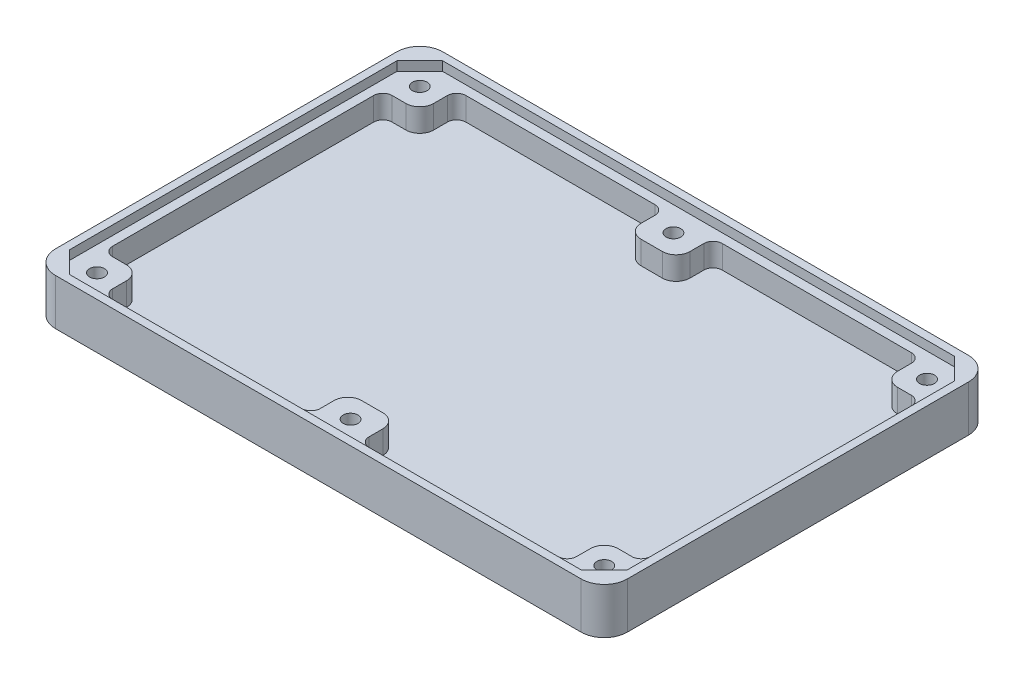
from build123d import *

# Parameters (mm, degrees)
SKETCH1_W           = 124
SKETCH1_H           = 84
BOSS_EXTRUDE1_DEPTH = 10
CUT_EXTRUDE1_DEPTH  = 2
SKETCH3_W           = 120.6
SKETCH3_H           = 60.6
CUT_EXTRUDE2_DEPTH  = 5
SKETCH4_W           = 45
SKETCH4_H           = 10
CUT_EXTRUDE3_DEPTH  = 5
FILLET1_R           = 3
FILLET2_R           = 5
SKETCH5_R           = 1.6
CUT_EXTRUDE4_DEPTH  = 238.548265663
SKETCH7_W           = 5.6
SKETCH7_H           = 7
CUT_EXTRUDE5_DEPTH  = 4
SKETCH8_W           = 100.6
SKETCH8_H           = 2
SKETCH8_W_2         = 2
SKETCH8_H_2         = 60.6
BOSS_EXTRUDE2_DEPTH = 5
FILLET3_R           = 2


with BuildPart() as part:
    # Sketch1 → Boss-Extrude1 (new body)
    with BuildSketch(Plane(origin=(0, 0, 0), x_dir=(1, 0, 0), z_dir=(0, 1, 0))):
        with Locations((-159.312972905, -43.940366204)):
            Rectangle(SKETCH1_W, SKETCH1_H)
    extrude(amount=BOSS_EXTRUDE1_DEPTH)

    # Sketch2 → Cut-Extrude1 (cut)
    with BuildSketch(Plane(origin=(0, 10, 0), x_dir=(1, 0, 0), z_dir=(0, 1, 0))):
        Polygon((-214.663225437, -3.640366204), (-219.612972905, -8.590113673), (-219.612972905, -79.590113673), (-214.962720373, -84.240366204), (-103.962720373, -84.240366204), (-99.012972905, -79.290618736), (-99.012972905, -8.290618736), (-103.663225437, -3.640366204), align=None)
    extrude(amount=-CUT_EXTRUDE1_DEPTH, mode=Mode.SUBTRACT)

    # Sketch3 → Cut-Extrude2 (cut)
    with BuildSketch(Plane(origin=(0, 8, 0), x_dir=(1, 0, 0), z_dir=(0, 1, 0))):
        with Locations((-159.312972905, -43.940366204)):
            Rectangle(SKETCH3_W, SKETCH3_H)
    extrude(amount=-CUT_EXTRUDE2_DEPTH, mode=Mode.SUBTRACT)

    # Sketch4 → Cut-Extrude3 (cut)
    with BuildSketch(Plane(origin=(0, 8, 0), x_dir=(1, 0, 0), z_dir=(0, 1, 0))):
        with Locations((-187.112972905, -8.640366204)):
            Rectangle(SKETCH4_W, SKETCH4_H)
        with Locations((-131.512972905, -8.640366204)):
            Rectangle(SKETCH4_W, SKETCH4_H)
        with Locations((-131.512972905, -79.240366204)):
            Rectangle(SKETCH4_W, SKETCH4_H)
        with Locations((-187.112972905, -79.240366204)):
            Rectangle(SKETCH4_W, SKETCH4_H)
    extrude(amount=-CUT_EXTRUDE3_DEPTH, mode=Mode.SUBTRACT)

    # Fillet1
    fillet1_edges = [part.edges().sort_by_distance(p)[0] for p in [
        (-209.612972905, 5.5, 74.240366204),
        (-164.612972905, 5.5, 74.240366204),
        (-109.012972905, 5.5, 74.240366204),
        (-154.012972905, 5.5, 74.240366204),
        (-154.012972905, 5.5, 13.640366204),
        (-109.012972905, 5.5, 13.640366204),
        (-209.612972905, 5.5, 13.640366204),
        (-164.612972905, 5.5, 13.640366204),
    ]]
    fillet(fillet1_edges, radius=FILLET1_R)

    # Fillet2
    fillet2_edges = [part.edges().sort_by_distance(p)[0] for p in [
        (-221.312972905, 5, 1.940366204),
        (-97.312972905, 5, 1.940366204),
        (-97.312972905, 5, 85.940366204),
        (-221.312972905, 5, 85.940366204),
    ]]
    fillet(fillet2_edges, radius=FILLET2_R)

    # Sketch5 → Cut-Extrude4 (cut, through all)
    with BuildSketch(Plane(origin=(0, 8, 0), x_dir=(1, 0, 0), z_dir=(0, 1, 0))):
        with Locations(Location((-214.312972905, -8.940366204, 0), (0, 0, 270))):
            Circle(SKETCH5_R)
        with Locations(Location((-159.312972905, -8.940366204, 0), (0, 0, 270))):
            Circle(SKETCH5_R)
        with Locations(Location((-104.312972905, -8.940366204, 0), (0, 0, 270))):
            Circle(SKETCH5_R)
        with Locations(Location((-104.312972905, -78.940366204, 0), (0, 0, 270))):
            Circle(SKETCH5_R)
        with Locations(Location((-159.312972905, -78.940366204, 0), (0, 0, 270))):
            Circle(SKETCH5_R)
        with Locations(Location((-214.312972905, -78.940366204, 0), (0, 0, 270))):
            Circle(SKETCH5_R)
    extrude(amount=-CUT_EXTRUDE4_DEPTH, mode=Mode.SUBTRACT)

    # Sketch7 → Cut-Extrude5 (cut)
    with BuildSketch(Plane.XZ):
        with Locations((-104.312972905, 8.940366204)):
            Rectangle(SKETCH7_W, SKETCH7_H)
        with Locations((-159.312972905, 8.940366204)):
            Rectangle(SKETCH7_W, SKETCH7_H)
        with Locations((-214.312972905, 8.940366204)):
            Rectangle(SKETCH7_W, SKETCH7_H)
        with Locations((-214.312972905, 78.940366204)):
            Rectangle(SKETCH7_W, SKETCH7_H)
        with Locations((-159.312972905, 78.940366204)):
            Rectangle(SKETCH7_W, SKETCH7_H)
        with Locations((-104.312972905, 78.940366204)):
            Rectangle(SKETCH7_W, SKETCH7_H)
    extrude(amount=-CUT_EXTRUDE5_DEPTH, mode=Mode.SUBTRACT)

    # Sketch8 → Boss-Extrude2 (add)
    with BuildSketch(Plane(origin=(0, 8, 0), x_dir=(1, 0, 0), z_dir=(0, 1, 0))):
        with Locations((-159.312972905, -83.240366204)):
            Rectangle(SKETCH8_W, SKETCH8_H)
        with Locations((-218.612972905, -43.940366204)):
            Rectangle(SKETCH8_W_2, SKETCH8_H_2)
        with Locations((-159.312972905, -4.640366204)):
            Rectangle(SKETCH8_W, SKETCH8_H)
        with Locations((-100.012972905, -43.940366204)):
            Rectangle(SKETCH8_W_2, SKETCH8_H_2)
    extrude(amount=-BOSS_EXTRUDE2_DEPTH)

    # Fillet3
    fillet3_edges = [part.edges().sort_by_distance(p)[0] for p in [
        (-209.612972905, 5.5, 82.240366204),
        (-109.012972905, 5.5, 82.240366204),
        (-154.012972905, 5.5, 82.240366204),
        (-164.612972905, 5.5, 82.240366204),
        (-217.612972905, 5.5, 13.640366204),
        (-217.612972905, 5.5, 74.240366204),
        (-109.012972905, 5.5, 5.640366204),
        (-209.612972905, 5.5, 5.640366204),
        (-164.612972905, 5.5, 5.640366204),
        (-154.012972905, 5.5, 5.640366204),
        (-101.012972905, 5.5, 74.240366204),
        (-101.012972905, 5.5, 13.640366204),
    ]]
    fillet(fillet3_edges, radius=FILLET3_R)


solid = part.part
